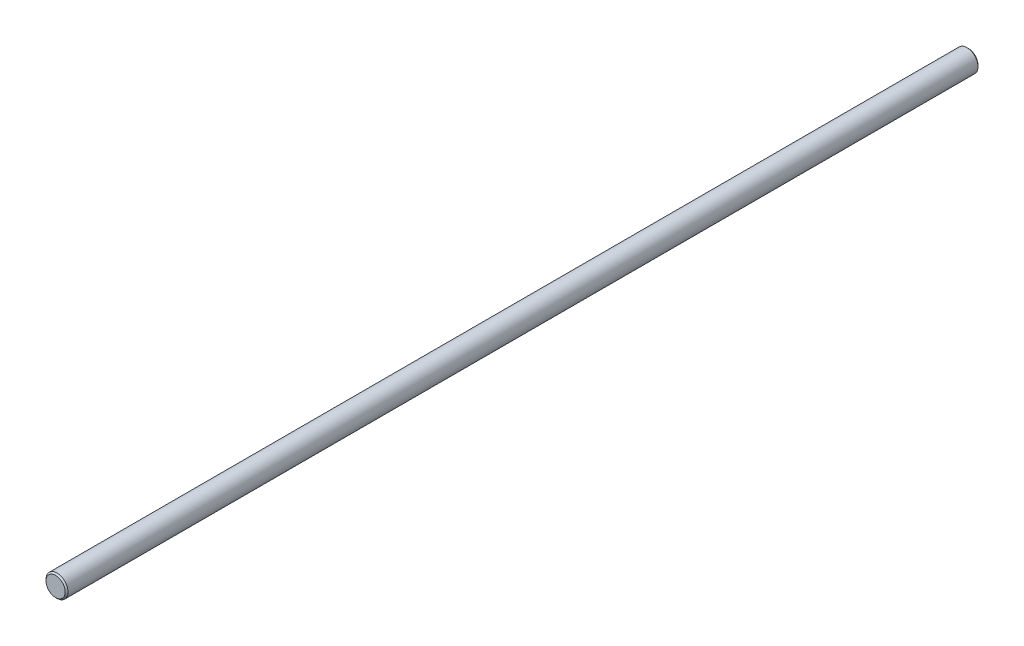
from build123d import *

# Parameters (mm, degrees)
CROQUIS1_R              = 4
SALIENTE_EXTRUIR1_DEPTH = 332.2
CHAFL_N1_SIZE           = 0.5


with BuildPart() as part:
    # Croquis1 → Saliente-Extruir1 (new body)
    with BuildSketch(Plane.XY):
        Circle(CROQUIS1_R)
    extrude(amount=-SALIENTE_EXTRUIR1_DEPTH)

    # Chaflán1
    chafl_n1_edges = [part.edges().sort_by_distance(p)[0] for p in [
        (-4, 0, 0),
        (-4, 0, -332.2),
    ]]
    chamfer(chafl_n1_edges, length=CHAFL_N1_SIZE)


solid = part.part
